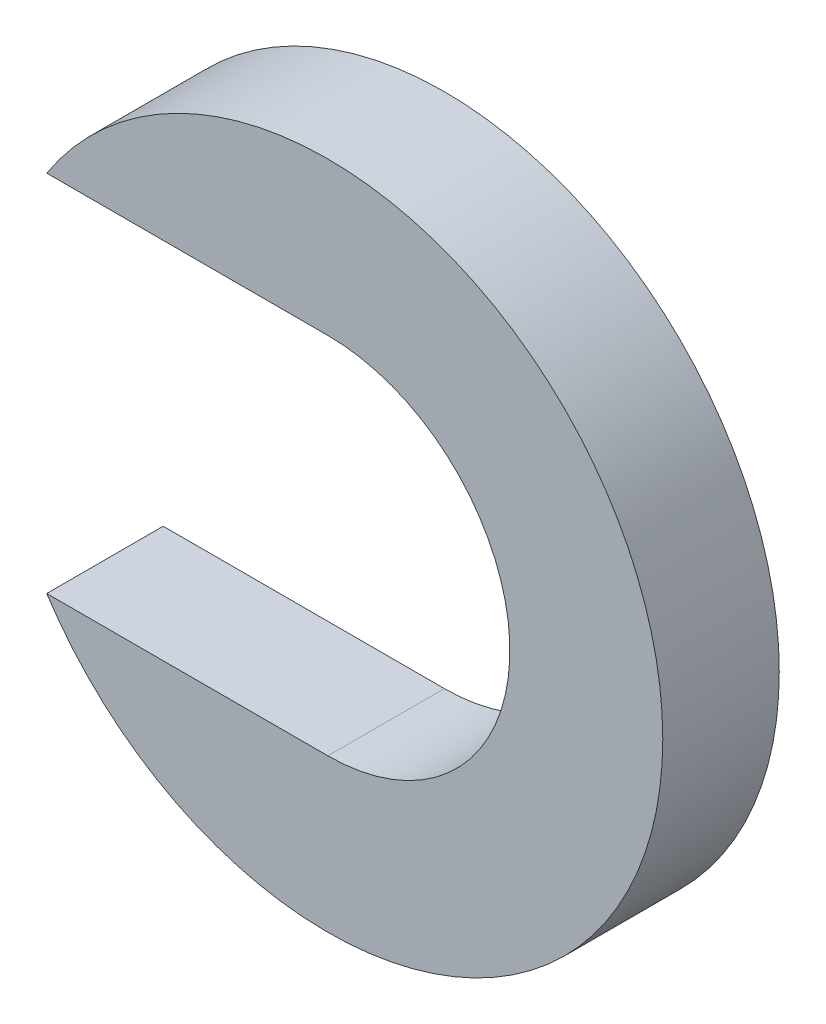
from build123d import *

# Parameters (mm, degrees)
CROQUIS1_R              = 9.128125
SALIENTE_EXTRUIR1_DEPTH = 3.175
CORTAR_EXTRUIR1_DEPTH   = 14.293831541


with BuildPart() as part:
    # Croquis1 → Saliente-Extruir1 (new body)
    with BuildSketch(Plane.XY):
        Circle(CROQUIS1_R)
    extrude(amount=SALIENTE_EXTRUIR1_DEPTH)

    # Croquis4 → Cortar-Extruir1 (cut, through all)
    with BuildSketch(Plane.XY.offset(3.175)):
        with BuildLine():
            Line((0, 4.9609375), (-7.662360285, 4.9609375))
            ThreePointArc((-7.662360285, 4.9609375), (-9.128125, 0), (-7.662360285, -4.9609375))
            Line((-7.662360285, -4.9609375), (0, -4.9609375))
            ThreePointArc((0, -4.9609375), (4.9609375, 0), (0, 4.9609375))
        make_face()
    extrude(amount=-CORTAR_EXTRUIR1_DEPTH, mode=Mode.SUBTRACT)


solid = part.part
